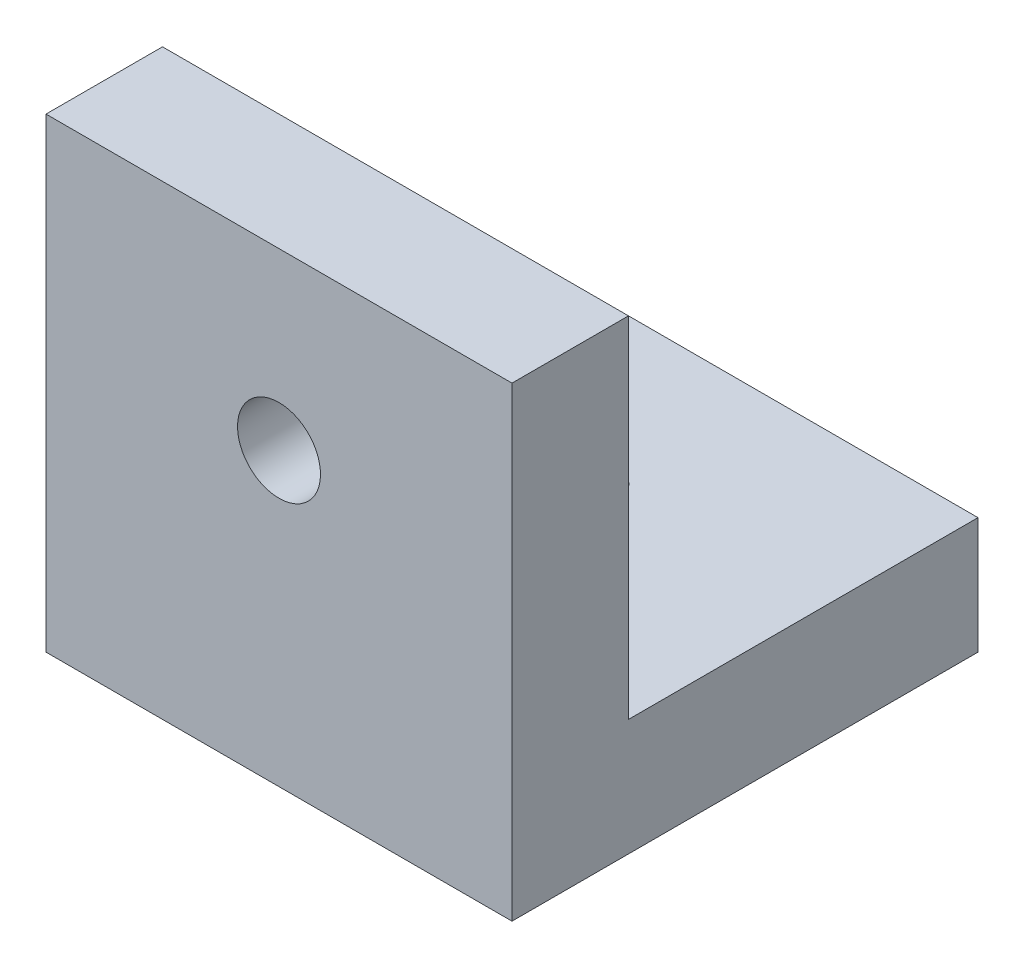
from build123d import *

# Parameters (mm, degrees)
BOSS_EXTRUDE1_DEPTH             = 12.7
F_43_0_089_DIAMETER_HOLE1_D     = 2.2606
F_43_0_089_DIAMETER_HOLE1_DEPTH = 25.4
F_43_0_089_DIAMETER_HOLE1_TIP   = 0.679152758
F_43_0_089_DIAMETER_HOLE2_D     = 2.2606
F_43_0_089_DIAMETER_HOLE2_DEPTH = 25.4
F_43_0_089_DIAMETER_HOLE2_TIP   = 0.679152758


with BuildPart() as part:
    # Sketch1 → Boss-Extrude1 (new body)
    with BuildSketch(Plane(origin=(0, 0, 0), x_dir=(0, 0, -1), z_dir=(1, 0, 0))):
        Polygon((0, 0), (0, 12.7), (3.175, 12.7), (3.175, 3.175), (12.7, 3.175), (12.7, 0), align=None)
    extrude(amount=BOSS_EXTRUDE1_DEPTH)

    # #43 (0.089) Diameter Hole1
    with Locations(Plane(origin=(0, 0, -3.175), x_dir=(-1, 0, 0), z_dir=(0, 0, -1))):
        with Locations((-6.35, 7.9375)):
            Hole(F_43_0_089_DIAMETER_HOLE1_D / 2, depth=F_43_0_089_DIAMETER_HOLE1_DEPTH)
            with Locations((0, 0, -(F_43_0_089_DIAMETER_HOLE1_DEPTH + F_43_0_089_DIAMETER_HOLE1_TIP / 2))):  # 118° drill point
                Cone(0, F_43_0_089_DIAMETER_HOLE1_D / 2, F_43_0_089_DIAMETER_HOLE1_TIP, mode=Mode.SUBTRACT)

    # #43 (0.089) Diameter Hole2
    with Locations(Plane(origin=(0, 3.175, 0), x_dir=(1, 0, 0), z_dir=(0, 1, 0))):
        with Locations((6.35, 7.9375)):
            Hole(F_43_0_089_DIAMETER_HOLE2_D / 2, depth=F_43_0_089_DIAMETER_HOLE2_DEPTH)
            with Locations((0, 0, -(F_43_0_089_DIAMETER_HOLE2_DEPTH + F_43_0_089_DIAMETER_HOLE2_TIP / 2))):  # 118° drill point
                Cone(0, F_43_0_089_DIAMETER_HOLE2_D / 2, F_43_0_089_DIAMETER_HOLE2_TIP, mode=Mode.SUBTRACT)


solid = part.part
